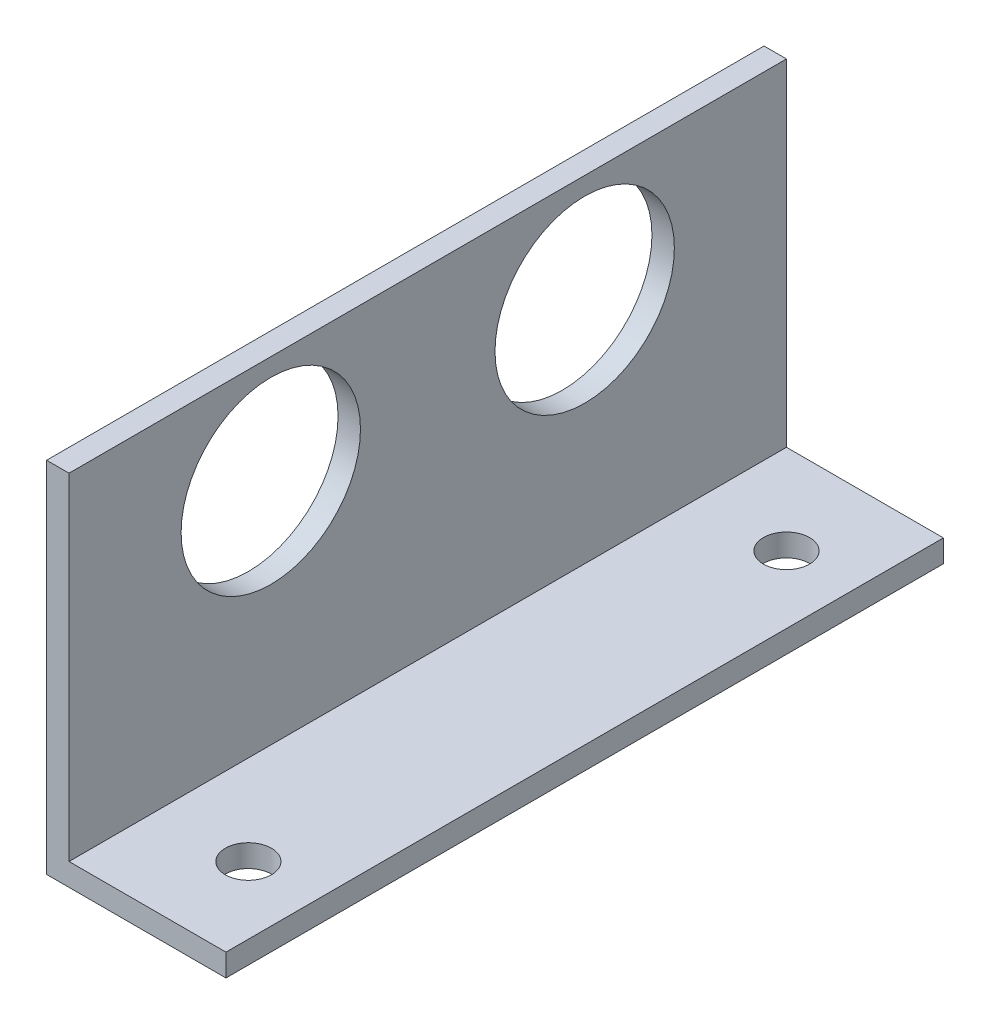
from build123d import *

# Parameters (mm, degrees)
BOSS_EXTRUDE1_DEPTH       = 25.4
SKETCH3_R                 = 6.35
CUT_EXTRUDE1_DEPTH        = 39.1
F_4_CLEARANCE_HOLE1_D     = 3.2639
F_4_CLEARANCE_HOLE1_DEPTH = 3.175
F_4_CLEARANCE_HOLE1_TIP   = 0.980574487


with BuildPart() as part:
    # Sketch1 → Boss-Extrude1 (new, symmetric)
    with BuildSketch(Plane.XY):
        Polygon((0, 0), (12.7, 0), (12.7, 1.5875), (1.5875, 1.5875), (1.5875, 25.4), (0, 25.4), align=None)
    extrude(amount=BOSS_EXTRUDE1_DEPTH, both=True)

    # Sketch3 → Cut-Extrude1 (cut, through all)
    with BuildSketch(Plane.ZY):
        with Locations((11.1125, 17.78)):
            Circle(SKETCH3_R)
        with Locations((-11.1125, 17.78)):
            Circle(SKETCH3_R)
    extrude(amount=-CUT_EXTRUDE1_DEPTH, mode=Mode.SUBTRACT)

    # #4 Clearance Hole1
    with Locations(Plane(origin=(0, 1.5875, 0), x_dir=(1, 0, 0), z_dir=(0, 1, 0))):
        with Locations((7.9375, 19.05), (7.9375, -19.05)):
            Hole(F_4_CLEARANCE_HOLE1_D / 2, depth=F_4_CLEARANCE_HOLE1_DEPTH)
            with Locations((0, 0, -(F_4_CLEARANCE_HOLE1_DEPTH + F_4_CLEARANCE_HOLE1_TIP / 2))):  # 118° drill point
                Cone(0, F_4_CLEARANCE_HOLE1_D / 2, F_4_CLEARANCE_HOLE1_TIP, mode=Mode.SUBTRACT)


solid = part.part
